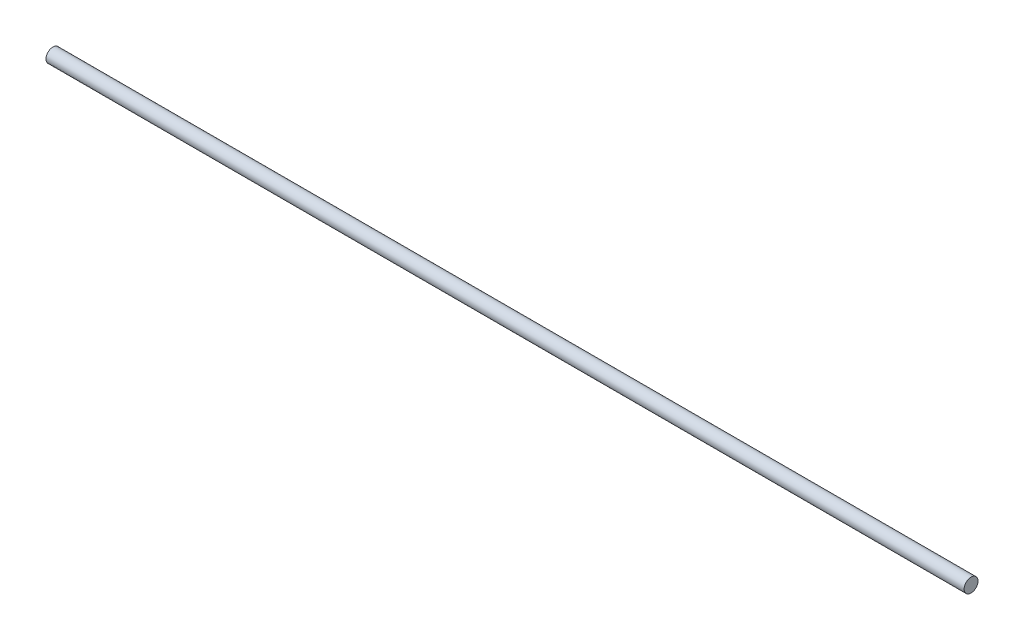
from build123d import *

# Parameters (mm, degrees)
SKETCH1_R           = 4.7625
BOSS_EXTRUDE1_DEPTH = 631.19


with BuildPart() as part:
    # Sketch1 → Boss-Extrude1 (new body)
    with BuildSketch(Plane.YZ):
        with Locations(Location((0, 0, 0), (0, 0, 270))):
            Circle(SKETCH1_R)
    extrude(amount=BOSS_EXTRUDE1_DEPTH)


solid = part.part
